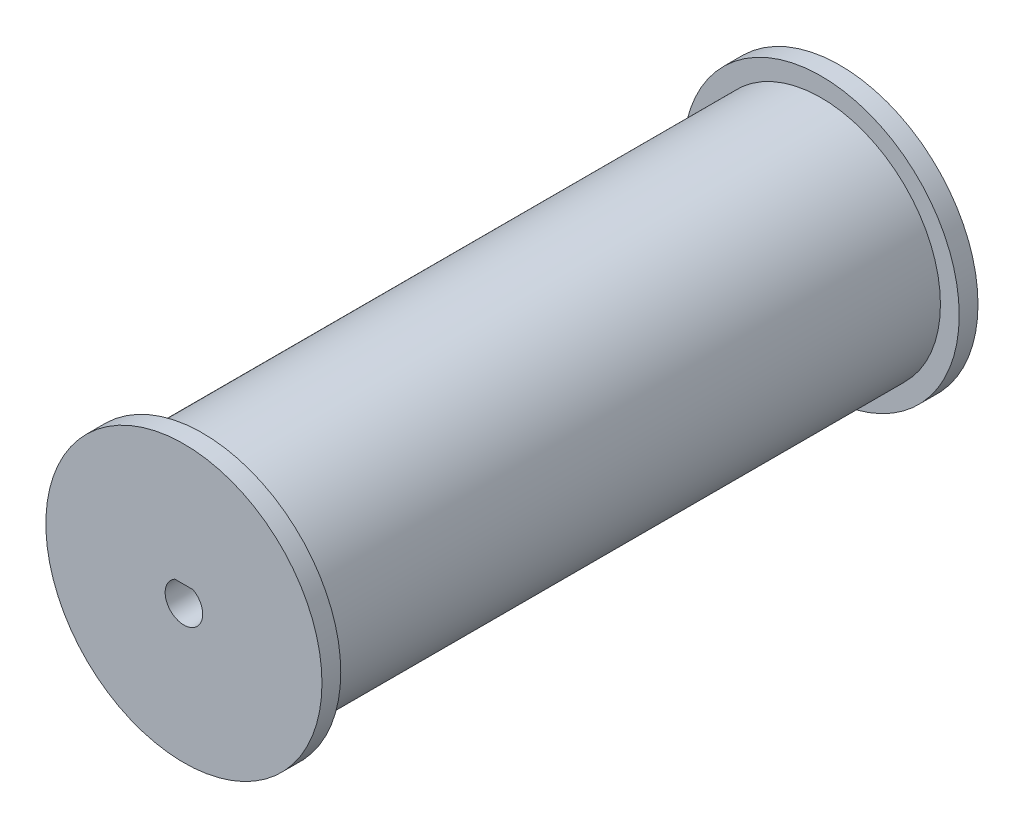
from build123d import *

# Parameters (mm, degrees)
SKETCH1_R           = 12.7
BOSS_EXTRUDE1_DEPTH = 69.85
CUT_EXTRUDE1_DEPTH  = 10
SKETCH3_R           = 2.999994
CUT_EXTRUDE2_DEPTH  = 34.925
SKETCH5_R           = 14.7
SKETCH5_R_2         = 2.999994
BOSS_EXTRUDE2_DEPTH = 2
BOSS_EXTRUDE5_START = 69.85
SKETCH8_R           = 14.7
BOSS_EXTRUDE5_DEPTH = 2


with BuildPart() as part:
    # Sketch1 → Boss-Extrude1 (new body)
    with BuildSketch(Plane.XY):
        Circle(SKETCH1_R)
    extrude(amount=BOSS_EXTRUDE1_DEPTH)

    # Sketch2 → Cut-Extrude1 (cut)
    with BuildSketch(Plane.XY.offset(69.85)):
        with BuildLine():
            Line((-0.968245837, 1.75), (0.968245837, 1.75))
            ThreePointArc((0.968245837, 1.75), (0, -2), (-0.968245837, 1.75))
        make_face()
    extrude(amount=-CUT_EXTRUDE1_DEPTH, mode=Mode.SUBTRACT)

    # Sketch3 → Cut-Extrude2 (cut)
    with BuildSketch(Plane(origin=(0, 0, 0), x_dir=(-1, 0, 0), z_dir=(0, 0, -1))):
        Circle(SKETCH3_R)
    extrude(amount=-CUT_EXTRUDE2_DEPTH, mode=Mode.SUBTRACT)

    # Sketch5 → Boss-Extrude2 (add)
    with BuildSketch(Plane.XY):
        Circle(SKETCH5_R)
        with Locations(Location((0, 0, 0), (0, 0, 180))):
            Circle(SKETCH5_R_2, mode=Mode.SUBTRACT)
    extrude(amount=BOSS_EXTRUDE2_DEPTH)

    # Sketch8 → Boss-Extrude5 (add)
    with BuildSketch(Plane.XY.offset(BOSS_EXTRUDE5_START)):
        Circle(SKETCH8_R)
        with BuildLine():
            Line((-0.968245837, 1.75), (0.968245837, 1.75))
            ThreePointArc((0.968245837, 1.75), (0, -2), (-0.968245837, 1.75))
        make_face(mode=Mode.SUBTRACT)
    extrude(amount=-BOSS_EXTRUDE5_DEPTH)


solid = part.part
